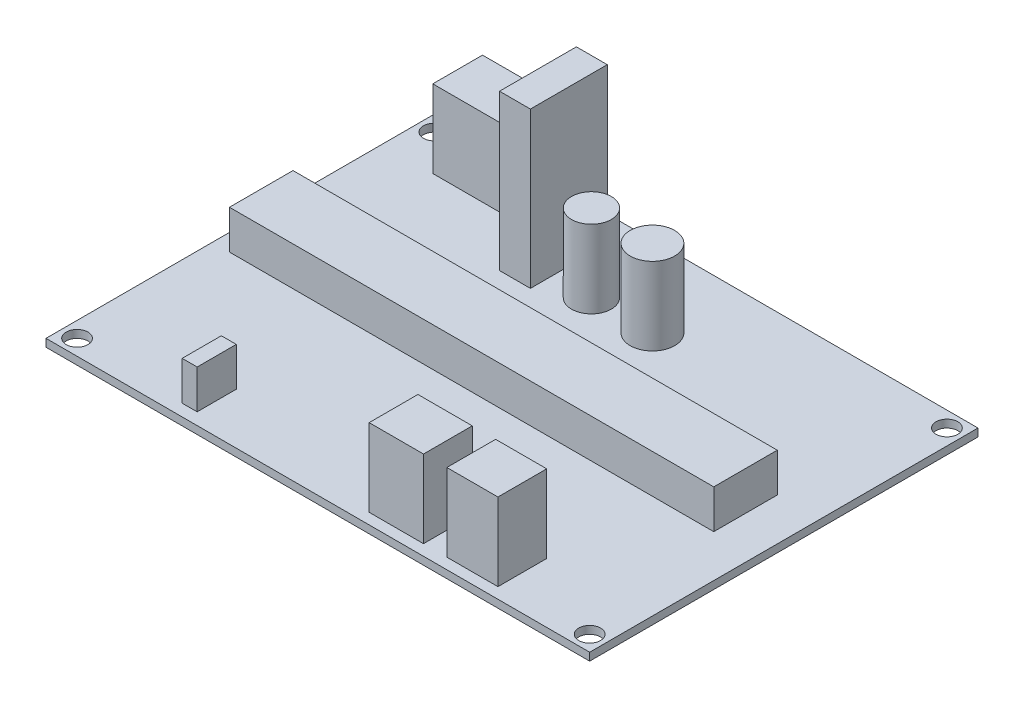
from build123d import *

# Parameters (mm, degrees)
SKETCH1_W           = 70
SKETCH1_H           = 50
BOSS_EXTRUDE1_DEPTH = 1
SKETCH2_R           = 1.4
CUT_EXTRUDE1_DEPTH  = 87.029064856
SKETCH3_R           = 2.564653552
SKETCH3_R_2         = 2.860541453
SKETCH3_W           = 6.997065393
SKETCH3_H           = 6.279852664
SKETCH3_W_2         = 6.578665668
SKETCH3_W_3         = 11.565083488
SKETCH3_H_2         = 6.404713395
BOSS_EXTRUDE2_DEPTH = 10
SKETCH5_W           = 62.355948398
SKETCH5_H           = 8.179994237
SKETCH5_W_2         = 1.926807787
SKETCH5_H_2         = 5.042884886
BOSS_EXTRUDE3_DEPTH = 5
SKETCH6_W           = 3.975602045
SKETCH6_H           = 9.897897773
BOSS_EXTRUDE4_DEPTH = 20


with BuildPart() as part:
    # Sketch1 → Boss-Extrude1 (new body)
    with BuildSketch(Plane(origin=(0, 0, 0), x_dir=(1, 0, 0), z_dir=(0, 1, 0))):
        with Locations((35, 25)):
            Rectangle(SKETCH1_W, SKETCH1_H)
    extrude(amount=BOSS_EXTRUDE1_DEPTH)

    # Sketch2 → Cut-Extrude1 (cut, through all)
    with BuildSketch(Plane(origin=(0, 1, 0), x_dir=(1, 0, 0), z_dir=(0, 1, 0))):
        with Locations(Location((2, 48, 0), (0, 0, 270))):
            Circle(SKETCH2_R)
        with Locations(Location((68, 48, 0), (0, 0, 270))):
            Circle(SKETCH2_R)
        with Locations(Location((68, 2, 0), (0, 0, 270))):
            Circle(SKETCH2_R)
        with Locations(Location((2, 2, 0), (0, 0, 270))):
            Circle(SKETCH2_R)
    extrude(amount=-CUT_EXTRUDE1_DEPTH, mode=Mode.SUBTRACT)

    # Sketch3 → Boss-Extrude2 (add)
    with BuildSketch(Plane(origin=(0, 1, 0), x_dir=(1, 0, 0), z_dir=(0, 1, 0))):
        with Locations(Location((30.577880589, 39.645889027, 0), (0, 0, 90))):
            Circle(SKETCH3_R)
        with Locations(Location((38.435044471, 39.645889027, 0), (0, 0, 90))):
            Circle(SKETCH3_R_2)
        with Locations((43.70288795, 4.543658094)):
            Rectangle(SKETCH3_W, SKETCH3_H)
        with Locations((53.497105797, 4.543658094)):
            Rectangle(SKETCH3_W_2, SKETCH3_H)
        with Locations((12.304871688, 46.48029873)):
            Rectangle(SKETCH3_W_3, SKETCH3_H_2)
    extrude(amount=BOSS_EXTRUDE2_DEPTH)

    # Sketch5 → Boss-Extrude3 (add)
    with BuildSketch(Plane(origin=(0, 1, 0), x_dir=(1, 0, 0), z_dir=(0, 1, 0))):
        with Locations((33.371807315, 25.517900554)):
            Rectangle(SKETCH5_W, SKETCH5_H)
        with Locations((16.963761322, 4.054342187)):
            Rectangle(SKETCH5_W_2, SKETCH5_H_2)
    extrude(amount=BOSS_EXTRUDE3_DEPTH)

    # Sketch6 → Boss-Extrude4 (add)
    with BuildSketch(Plane(origin=(0, 1, 0), x_dir=(1, 0, 0), z_dir=(0, 1, 0))):
        with Locations((23.62978258, 41.700410586)):
            Rectangle(SKETCH6_W, SKETCH6_H)
    extrude(amount=BOSS_EXTRUDE4_DEPTH)


solid = part.part
